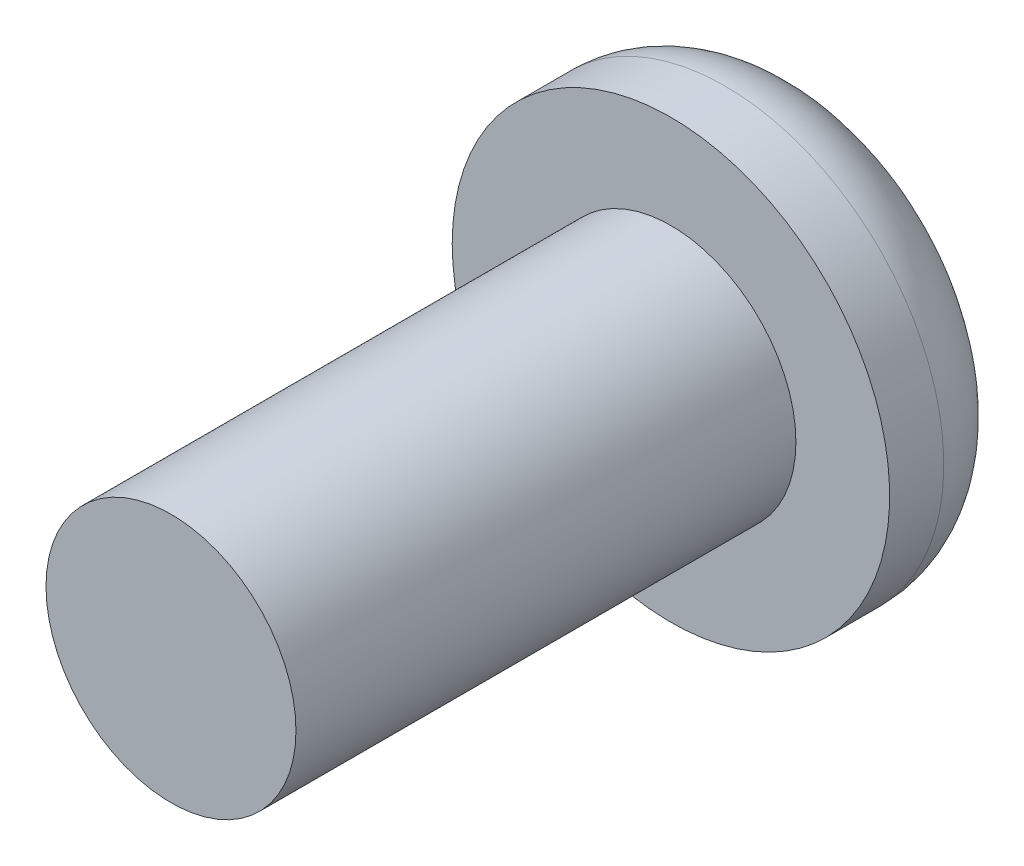
from build123d import *

# Parameters (mm, degrees)
SKETCH_1_R      = 3
EXTRUDE_1_DEPTH = 12
SKETCH_2_R      = 5.25
EXTRUDE_2_DEPTH = 3.3
FILLET_1_R      = 2


with BuildPart() as part:
    # 草图1 → 凸台-拉伸1 (new body)
    with BuildSketch(Plane.XY):
        Circle(SKETCH_1_R)
    extrude(amount=EXTRUDE_1_DEPTH)

    # 草图2 → 凸台-拉伸2 (add)
    with BuildSketch(Plane(origin=(0, 0, 0), x_dir=(-1, 0, 0), z_dir=(0, 0, -1))):
        Circle(SKETCH_2_R)
    extrude(amount=EXTRUDE_2_DEPTH)

    # 圆角1
    fillet_1_edges = [part.edges().sort_by_distance(p)[0] for p in [
        (5.25, 0, -3.3),
    ]]
    fillet(fillet_1_edges, radius=FILLET_1_R)


solid = part.part
